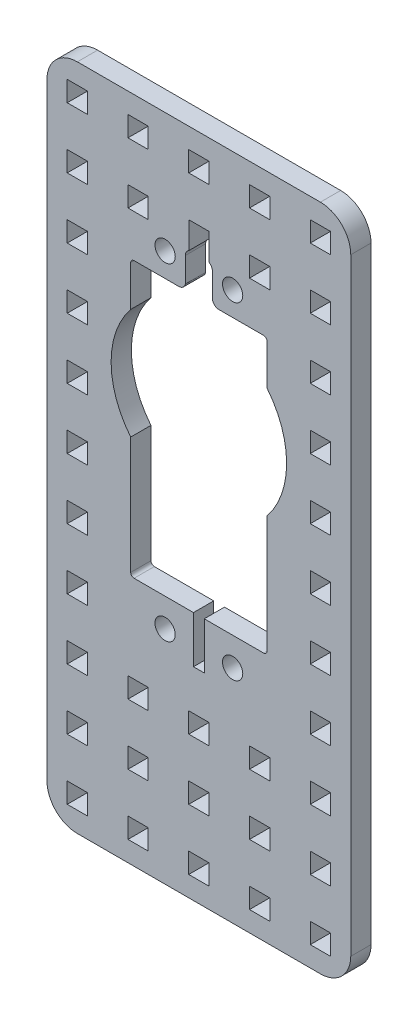
from build123d import *

# Parameters (mm, degrees)
MODEL_R                 = 1.5
MODEL_W                 = 3
MODEL_H                 = 3
SALIENTE_EXTRUIR1_DEPTH = 3


with BuildPart() as part:
    # Model → Saliente-Extruir1 (new body)
    with BuildSketch(Plane.XY):
        with BuildLine():
            Line((17.356035274, 193.902048875), (53.356035274, 193.902048875))
            ThreePointArc((53.356035274, 193.902048875), (56.53801579, 195.22006836), (57.856035274, 198.402048875))
            Line((57.856035274, 198.402048875), (57.856035274, 288.402048875))
            ThreePointArc((57.856035274, 288.402048875), (56.53801579, 291.58402939), (53.356035274, 292.902048875))
            Line((53.356035274, 292.902048875), (17.356035274, 292.902048875))
            ThreePointArc((17.356035274, 292.902048875), (14.174054759, 291.58402939), (12.856035274, 288.402048875))
            Line((12.856035274, 288.402048875), (12.856035274, 198.402048875))
            ThreePointArc((12.856035274, 198.402048875), (14.174054759, 195.22006836), (17.356035274, 193.902048875))
        make_face()
        with Locations((40.355847758, 226.651825621)):
            Circle(MODEL_R, mode=Mode.SUBTRACT)
        with Locations((30.355847768, 226.652272077)):
            Circle(MODEL_R, mode=Mode.SUBTRACT)
        with Locations((40.358013069, 275.151825573)):
            Circle(MODEL_R, mode=Mode.SUBTRACT)
        with Locations((30.35801308, 275.152272029)):
            Circle(MODEL_R, mode=Mode.SUBTRACT)
        with Locations((53.356035274, 288.402048875)):
            Rectangle(MODEL_W, MODEL_H, mode=Mode.SUBTRACT)
        with Locations((53.356035274, 279.402048875)):
            Rectangle(MODEL_W, MODEL_H, mode=Mode.SUBTRACT)
        with Locations((53.356035274, 270.402048875)):
            Rectangle(MODEL_W, MODEL_H, mode=Mode.SUBTRACT)
        with Locations((53.356035274, 261.402048875)):
            Rectangle(MODEL_W, MODEL_H, mode=Mode.SUBTRACT)
        with Locations((53.356035274, 252.402048875)):
            Rectangle(MODEL_W, MODEL_H, mode=Mode.SUBTRACT)
        with Locations((53.356035274, 243.402048875)):
            Rectangle(MODEL_W, MODEL_H, mode=Mode.SUBTRACT)
        with Locations((53.356035274, 234.402048875)):
            Rectangle(MODEL_W, MODEL_H, mode=Mode.SUBTRACT)
        with Locations((53.356035274, 225.402048875)):
            Rectangle(MODEL_W, MODEL_H, mode=Mode.SUBTRACT)
        with Locations((53.356035274, 216.402048875)):
            Rectangle(MODEL_W, MODEL_H, mode=Mode.SUBTRACT)
        with Locations((53.356035274, 207.402048875)):
            Rectangle(MODEL_W, MODEL_H, mode=Mode.SUBTRACT)
        with Locations((53.356035274, 198.402048875)):
            Rectangle(MODEL_W, MODEL_H, mode=Mode.SUBTRACT)
        with Locations((17.356035274, 288.402048875)):
            Rectangle(MODEL_W, MODEL_H, mode=Mode.SUBTRACT)
        with Locations((17.356035274, 279.402048875)):
            Rectangle(MODEL_W, MODEL_H, mode=Mode.SUBTRACT)
        with Locations((17.356035274, 270.402048875)):
            Rectangle(MODEL_W, MODEL_H, mode=Mode.SUBTRACT)
        with Locations((17.356035274, 261.402048875)):
            Rectangle(MODEL_W, MODEL_H, mode=Mode.SUBTRACT)
        with Locations((17.356035274, 252.402048875)):
            Rectangle(MODEL_W, MODEL_H, mode=Mode.SUBTRACT)
        with Locations((17.356035274, 243.402048875)):
            Rectangle(MODEL_W, MODEL_H, mode=Mode.SUBTRACT)
        with Locations((17.356035274, 234.402048875)):
            Rectangle(MODEL_W, MODEL_H, mode=Mode.SUBTRACT)
        with Locations((17.356035274, 225.402048875)):
            Rectangle(MODEL_W, MODEL_H, mode=Mode.SUBTRACT)
        with Locations((17.356035274, 216.402048875)):
            Rectangle(MODEL_W, MODEL_H, mode=Mode.SUBTRACT)
        with Locations((17.356035274, 207.402048875)):
            Rectangle(MODEL_W, MODEL_H, mode=Mode.SUBTRACT)
        with Locations((17.356035274, 198.402048875)):
            Rectangle(MODEL_W, MODEL_H, mode=Mode.SUBTRACT)
        with Locations((44.356035274, 198.402048875)):
            Rectangle(MODEL_W, MODEL_H, mode=Mode.SUBTRACT)
        with Locations((26.356035274, 198.402048875)):
            Rectangle(MODEL_W, MODEL_H, mode=Mode.SUBTRACT)
        with Locations((35.356035274, 198.402048875)):
            Rectangle(MODEL_W, MODEL_H, mode=Mode.SUBTRACT)
        with Locations((44.356035274, 216.402048875)):
            Rectangle(MODEL_W, MODEL_H, mode=Mode.SUBTRACT)
        with Locations((26.356035274, 216.402048875)):
            Rectangle(MODEL_W, MODEL_H, mode=Mode.SUBTRACT)
        with Locations((35.356035274, 216.402048875)):
            Rectangle(MODEL_W, MODEL_H, mode=Mode.SUBTRACT)
        with Locations((44.356035274, 207.402048875)):
            Rectangle(MODEL_W, MODEL_H, mode=Mode.SUBTRACT)
        with Locations((26.356035274, 207.402048875)):
            Rectangle(MODEL_W, MODEL_H, mode=Mode.SUBTRACT)
        with Locations((35.356035274, 207.402048875)):
            Rectangle(MODEL_W, MODEL_H, mode=Mode.SUBTRACT)
        with Locations((44.356035274, 288.402048875)):
            Rectangle(MODEL_W, MODEL_H, mode=Mode.SUBTRACT)
        with Locations((26.356035274, 288.402048875)):
            Rectangle(MODEL_W, MODEL_H, mode=Mode.SUBTRACT)
        with Locations((35.356035274, 288.402048875)):
            Rectangle(MODEL_W, MODEL_H, mode=Mode.SUBTRACT)
        with Locations((44.356035274, 279.402048875)):
            Rectangle(MODEL_W, MODEL_H, mode=Mode.SUBTRACT)
        with Locations((26.356035274, 279.402048875)):
            Rectangle(MODEL_W, MODEL_H, mode=Mode.SUBTRACT)
        with BuildLine():
            Line((33.857854573, 280.901620206), (33.857854573, 276.931747225))
            ThreePointArc((33.857854573, 276.931747225), (33.491829169, 276.565721821), (33.357854573, 276.065721821))
            Line((33.357854573, 276.065721821), (33.357854573, 272.401620206))
            ThreePointArc((33.357854573, 272.401620206), (33.010514208, 271.827023537), (32.378058676, 271.601620206))
            Line((32.378058676, 271.601620206), (25.757854573, 271.601620206))
            ThreePointArc((25.757854573, 271.601620206), (25.404597365, 271.455492569), (25.25783227, 271.102499725))
            Line((25.25783227, 271.102499725), (25.25756379, 265.088924432))
            ThreePointArc((25.25756379, 265.088924432), (22.355834382, 256.902629272), (25.256832814, 248.716075046))
            Line((25.256832814, 248.716075046), (25.256057607, 231.352499765))
            ThreePointArc((25.256057607, 231.352499765), (25.402488432, 230.998939836), (25.756035284, 230.852477443))
            Line((25.756035284, 230.852477443), (34.556035275, 230.852084561))
            Line((34.556035275, 230.852084561), (34.555724988, 223.902084568))
            Line((34.555724988, 223.902084568), (36.155724986, 223.902013135))
            Line((36.155724986, 223.902013135), (36.156035273, 230.852013128))
            Line((36.156035273, 230.852013128), (44.956035265, 230.851620247))
            ThreePointArc((44.956035265, 230.851620247), (45.309595193, 230.998051072), (45.456057587, 231.351597924))
            Line((45.456057587, 231.351597924), (45.456832945, 248.718539377))
            ThreePointArc((45.456832945, 248.718539377), (48.355834356, 256.901468487), (45.45756362, 265.084656419))
            Line((45.45756362, 265.084656419), (45.45783225, 271.101597884))
            ThreePointArc((45.45783225, 271.101597884), (45.311401425, 271.455157812), (44.957854573, 271.601620206))
            Line((44.957854573, 271.601620206), (38.33765047, 271.601620206))
            ThreePointArc((38.33765047, 271.601620206), (37.705194938, 271.827023537), (37.357854573, 272.401620206))
            Line((37.357854573, 272.401620206), (37.357854573, 276.065721821))
            ThreePointArc((37.357854573, 276.065721821), (37.223879977, 276.565721821), (36.857854573, 276.931747225))
            Line((36.857854573, 276.931747225), (36.857854573, 280.901620206))
            Line((36.857854573, 280.901620206), (33.857854573, 280.901620206))
        make_face(mode=Mode.SUBTRACT)
    extrude(amount=SALIENTE_EXTRUIR1_DEPTH)


solid = part.part
